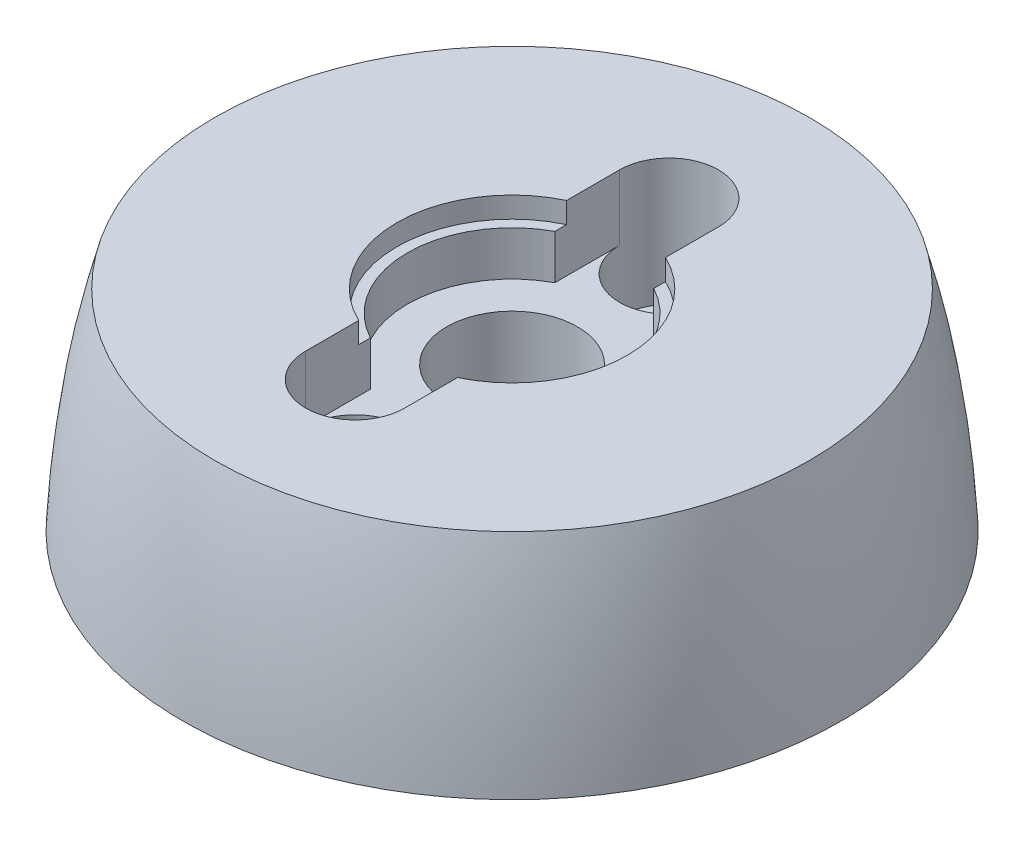
from build123d import *

# Parameters (mm, degrees)
CBORE_FOR_M3_HEX_HEAD_BOLT1_D           = 3.4
CBORE_FOR_M3_HEX_HEAD_BOLT1_CBORE_D     = 6
CBORE_FOR_M3_HEX_HEAD_BOLT1_CBORE_DEPTH = 35
CUT_EXTRUDE1_DEPTH                      = 43.521318352
CUT_EXTRUDE1_DEPTH_BACK                 = 43.521318352
SKETCH1_W                               = 45.460757026
SKETCH1_H                               = 38.1
CUT_EXTRUDE2_DEPTH                      = 3.96875
SKETCH3_R                               = 6.985
CUT_EXTRUDE3_DEPTH                      = 1.27
SKETCH4_R                               = 3.96875
CUT_EXTRUDE4_DEPTH                      = 30.601262411


with BuildPart() as part:
    # 草图1 → 旋转1 (revolve)
    with BuildSketch(Plane.XY):
        with BuildLine():
            Line((0, 0), (0, 31.75))
            Line((0, 31.75), (5.477501396, 31.75))
            add(Edge.make_bspline(
                [(5.477501396, 31.75), (16.24161295, 23.874290145), (19.406701728, 11.219456234), (20, 0)],
                knots=[0.132414506, 0.132414506, 0.132414506, 0.132414506, 1, 1, 1, 1], degree=3))
            Line((20, 0), (0, 0))
        make_face()
    revolve(axis=Axis((0, 0, 0), (0, 1, 0)))

    # CBORE for M3 Hex Head Bolt1 (through all)
    with Locations(Plane(origin=(0, 40, 0), x_dir=(-1, 0, 0), z_dir=(0, 1, 0))):
        with Locations((0, -9.525), (0, 9.525)):
            CounterBoreHole(CBORE_FOR_M3_HEX_HEAD_BOLT1_D / 2, CBORE_FOR_M3_HEX_HEAD_BOLT1_CBORE_D / 2, CBORE_FOR_M3_HEX_HEAD_BOLT1_CBORE_DEPTH)

    # Sketch1 → Cut-Extrude1 (cut, two sides: drawn at the far end of the back side and taken through both)
    with BuildSketch(Plane.XY.offset(-CUT_EXTRUDE1_DEPTH_BACK)):
        with Locations((0, 31.75)):
            Rectangle(SKETCH1_W, SKETCH1_H)
    extrude(amount=CUT_EXTRUDE1_DEPTH + CUT_EXTRUDE1_DEPTH_BACK, mode=Mode.SUBTRACT)

    # Sketch2 → Cut-Extrude2 (cut)
    with BuildSketch(Plane(origin=(0, 12.7, 0), x_dir=(1, 0, 0), z_dir=(0, 1, 0))):
        with BuildLine():
            Line((-3, 9.525), (-3, 5.596650784))
            ThreePointArc((-3, 5.596650784), (-6.35, 0), (-3, -5.596650784))
            Line((-3, -5.596650784), (-3, -9.525))
            ThreePointArc((-3, -9.525), (0, -12.525), (3, -9.525))
            Line((3, -9.525), (3, -5.596650784))
            ThreePointArc((3, -5.596650784), (6.35, 0), (3, 5.596650784))
            Line((3, 5.596650784), (3, 9.525))
            ThreePointArc((3, 9.525), (0, 12.525), (-3, 9.525))
        make_face()
    extrude(amount=-CUT_EXTRUDE2_DEPTH, mode=Mode.SUBTRACT)

    # Sketch3 → Cut-Extrude3 (cut)
    with BuildSketch(Plane(origin=(0, 12.7, 0), x_dir=(1, 0, 0), z_dir=(0, 1, 0))):
        Circle(SKETCH3_R)
    extrude(amount=-CUT_EXTRUDE3_DEPTH, mode=Mode.SUBTRACT)

    # Sketch4 → Cut-Extrude4 (cut, through all)
    with BuildSketch(Plane(origin=(0, 8.73125, 0), x_dir=(1, 0, 0), z_dir=(0, 1, 0))):
        with Locations(Location((0, 0, 0), (0, 0, 270))):
            Circle(SKETCH4_R)
    extrude(amount=-CUT_EXTRUDE4_DEPTH, mode=Mode.SUBTRACT)


solid = part.part
